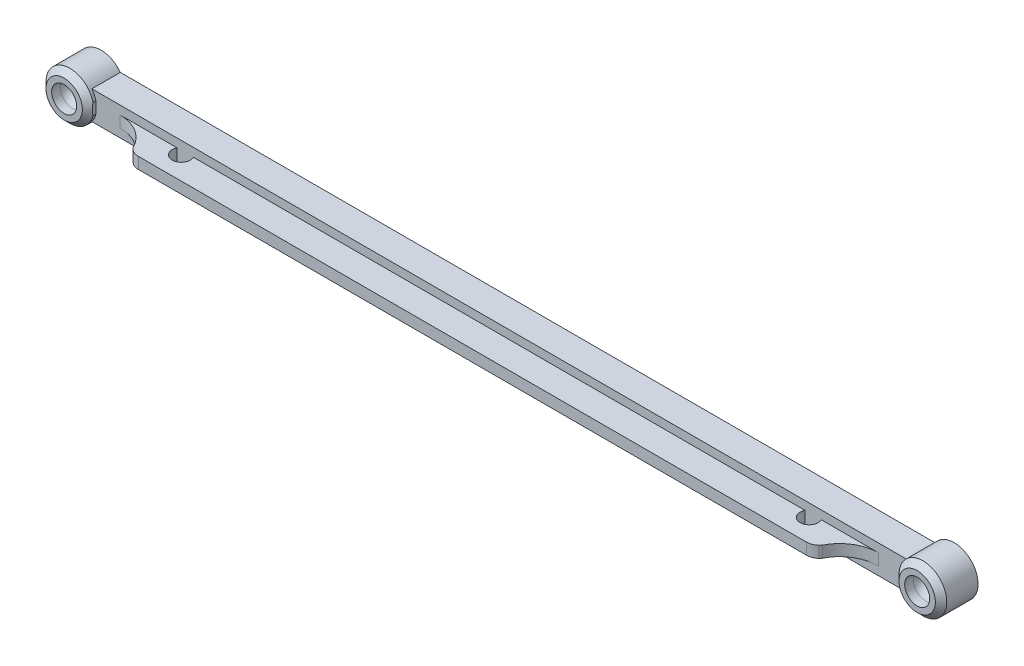
from build123d import *

# Parameters (mm, degrees)
EXTRUDE_1_REACH                  = 81.748
EXTRUDE_1_END_RADIUS             = 4.2
EXTRUDE_1_DIRECTION_2_REACH      = 81.748
EXTRUDE_1_DIRECTION_2_END_RADIUS = 4.2
CUT_EXTRUDE_2_DEPTH              = 155.592270182
CUT_EXTRUDE_3_DEPTH              = 155.592270182


with BuildPart() as part:
    # 스케치1 → 회전2 (revolve)
    with BuildSketch(Plane(origin=(0, 0, 0), x_dir=(0, 0, -1), z_dir=(1, 0, 0))):
        with BuildLine():
            Line((-6.500191237, 4.698061575), (-5.000191237, 4.698061575))
            ThreePointArc((-5.000191237, 4.698061575), (-3.517605127, 4.040424575), (-3.010022497, 2.5))
            Line((-3.010022497, 2.5), (0, 2.5))
            Line((0, 2.5), (0, 6.7))
            Line((0, 6.7), (-5.5, 6.7))
            Line((-5.5, 6.7), (-6.500191237, 5.698061575))
            Line((-6.500191237, 5.698061575), (-6.500191237, 4.698061575))
        make_face()
    revolve(axis=Axis((0, 2.5, -8.961352657), (0, 0, 1)))



with BuildPart() as body_2:
    # 스케치2 → 회전3 (revolve)
    with BuildSketch(Plane(origin=(150, 0, 0), x_dir=(0, 0, -1), z_dir=(1, 0, 0)), mode=Mode.PRIVATE) as revolve_3_sk:
        with BuildLine():
            Line((0, 2.5), (0, 6.7))
            Line((0, 6.7), (-5.5, 6.7))
            Line((-5.5, 6.7), (-6.500191237, 5.698061575))
            Line((-6.500191237, 5.698061575), (-6.500191237, 4.698061575))
            Line((-6.500191237, 4.698061575), (-5.000191237, 4.698061575))
            ThreePointArc((-5.000191237, 4.698061575), (-3.517605127, 4.040424575), (-3.010022497, 2.5))
            Line((-3.010022497, 2.5), (0, 2.5))
        make_face()
    revolve(revolve_3_sk.sketch.rotate(Axis((150, 2.5, 3.010022497), (0, 0, -1)), 180), axis=Axis((150, 2.5, 3.010022497), (0, 0, -1)))


with BuildPart() as part_1:
    add(part.part)

    add(body_2.part)  # 보스-돌출1 merges body 2
    # 보스-돌출1: up to this cylinder (the profile starts outside it)
    extrude_1_end = Plane(origin=(150, 2.5, 3.825291), z_dir=(0, 0, 1)) * Cylinder(EXTRUDE_1_END_RADIUS, 172.896, mode=Mode.PRIVATE)
    # 스케치3 → 보스-돌출1 (add, up to the surface)
    with BuildSketch(Plane(origin=(75, 0, 0), x_dir=(0, 0, -1), z_dir=(1, 0, 0)), mode=Mode.PRIVATE) as extrude_1_sk1:
        Polygon((-5, 3.5), (-5, 5), (0, 5), (0, 0), (-5, 0), (-5, 1.5), (-9.7, 1.5), (-9.7, 3.5), align=None)
    extrude_1_tool1 = extrude(extrude_1_sk1.sketch, amount=EXTRUDE_1_REACH, mode=Mode.PRIVATE) - extrude_1_end
    add(extrude_1_tool1.solids().sort_by_distance((75, 2.5, 3.825291))[0])

    # 보스-돌출1 direction 2: up to this cylinder (the profile starts outside it)
    extrude_1_direction_2_end = Plane(origin=(0, 2.5, 3.825291), z_dir=(0, 0, -1)) * Cylinder(EXTRUDE_1_DIRECTION_2_END_RADIUS, 172.896, mode=Mode.PRIVATE)
    # 스케치3 → 보스-돌출1 direction 2 (add, up to the surface)
    with BuildSketch(Plane(origin=(75, 0, 0), x_dir=(0, 0, -1), z_dir=(1, 0, 0)), mode=Mode.PRIVATE) as extrude_1_direction_2_sk1:
        Polygon((-5, 3.5), (-5, 5), (0, 5), (0, 0), (-5, 0), (-5, 1.5), (-9.7, 1.5), (-9.7, 3.5), align=None)
    extrude_1_direction_2_tool1 = extrude(extrude_1_direction_2_sk1.sketch, amount=-EXTRUDE_1_DIRECTION_2_REACH, mode=Mode.PRIVATE) - extrude_1_direction_2_end
    add(extrude_1_direction_2_tool1.solids().sort_by_distance((75, 2.5, 3.825291))[0])

    # 스케치4 → 컷-돌출2 (cut, through all)
    with BuildSketch(Plane.XZ.offset(-1.5)):
        with BuildLine():
            Line((145.920784389, 9.7), (133.73, 9.7))
            ThreePointArc((133.73, 9.7), (134.59, 9.536801651), (135.330428215, 9.069897208))
            Line((135.330428215, 9.069897208), (135.567873872, 8.812759968))
            ThreePointArc((135.567873872, 8.812759968), (138.083605002, 6.031129475), (141.689592152, 5))
            Line((141.689592152, 5), (145.920784389, 5))
            Line((145.920784389, 5), (145.920784389, 9.7))
        make_face()
        with BuildLine():
            ThreePointArc((14.669571785, 9.069897208), (15.41, 9.536801651), (16.27, 9.7))
            Line((16.27, 9.7), (4.079215611, 9.7))
            Line((4.079215611, 9.7), (4.079215611, 5))
            Line((4.079215611, 5), (8.310407839, 5))
            ThreePointArc((8.310407839, 5), (11.916394994, 6.031129473), (14.432126128, 8.812759968))
            Line((14.432126128, 8.812759968), (14.669571785, 9.069897208))
        make_face()
    extrude(amount=-CUT_EXTRUDE_2_DEPTH, mode=Mode.SUBTRACT)

    # 스케치6 → 컷-돌출3 (cut, through all)
    with BuildSketch(Plane.XZ.offset(-1.5)):
        with BuildLine():
            ThreePointArc((21.233, 5), (19.7945, 7.300512491), (18.356, 5))
            Line((18.356, 5), (21.233, 5))
        make_face()
        with BuildLine():
            ThreePointArc((131.644, 5), (130.2055, 7.300512491), (128.767, 5))
            Line((128.767, 5), (131.644, 5))
        make_face()
    extrude(amount=-CUT_EXTRUDE_3_DEPTH, mode=Mode.SUBTRACT)


solid = part_1.part
